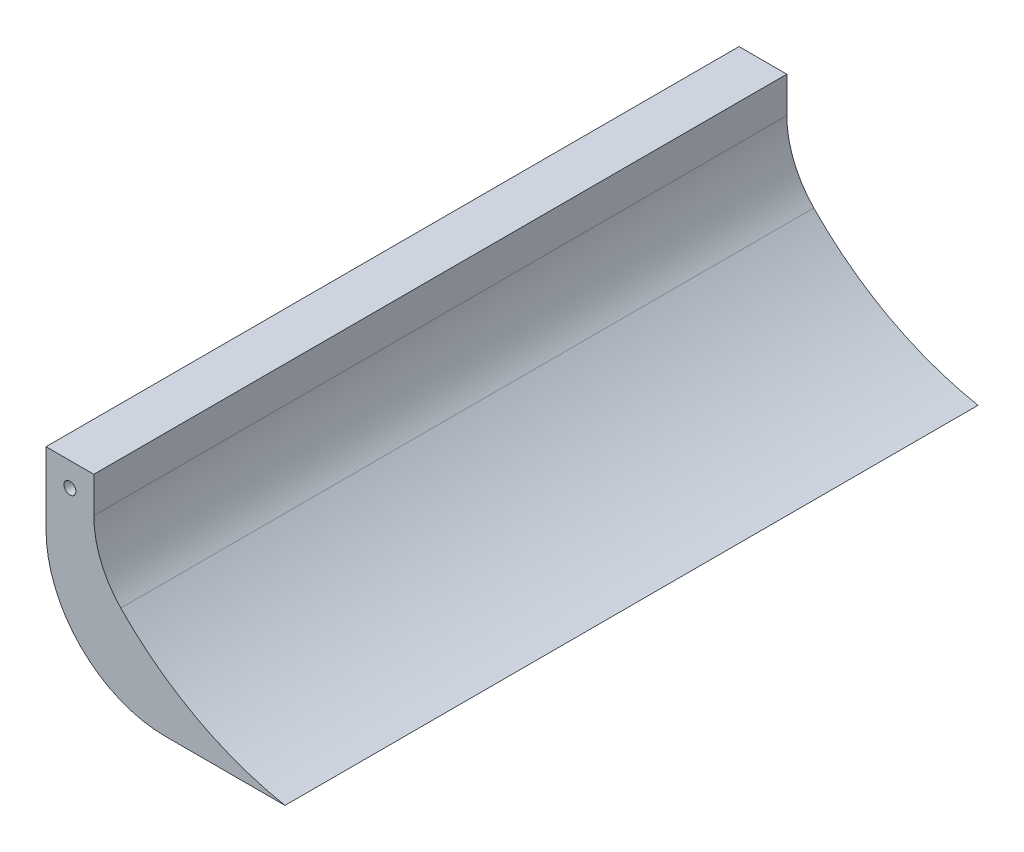
from build123d import *

# Parameters (mm, degrees)
SKETCH1_R           = 3.175
BOSS_EXTRUDE1_DEPTH = 368.3


with BuildPart() as part:
    # Sketch1 → Boss-Extrude1 (new body)
    with BuildSketch(Plane.XY):
        with BuildLine():
            Line((63.5, 0), (127, 0))
            ThreePointArc((127, 0), (79.735551891, 16.883756508), (39.72796149, 47.188574592))
            ThreePointArc((39.72796149, 47.188574592), (29.118052524, 63.473044744), (25.4, 82.55))
            Line((25.4, 82.55), (25.4, 101.6))
            Line((25.4, 101.6), (0, 101.6))
            Line((0, 101.6), (0, 63.5))
            ThreePointArc((0, 63.5), (18.598719395, 18.598719395), (63.5, 0))
        make_face()
        with Locations((12.7, 88.9)):
            Circle(SKETCH1_R, mode=Mode.SUBTRACT)
    extrude(amount=BOSS_EXTRUDE1_DEPTH)


solid = part.part
